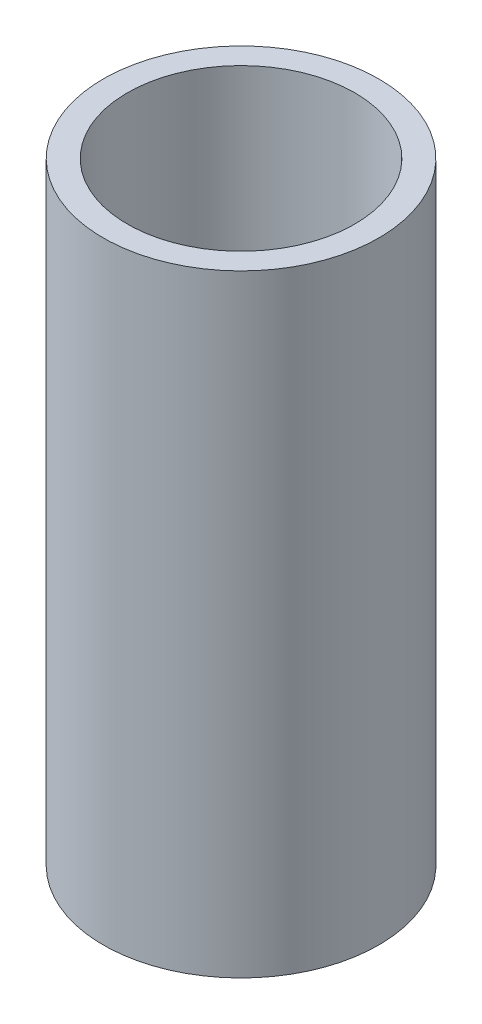
from build123d import *


with BuildPart() as part:
    # Szkic1 → Obrót1 (revolve)
    with BuildSketch(Plane.XY, mode=Mode.PRIVATE) as obr_t1_sk:
        Polygon((-19.02, 100.112987953), (-19.02, 7.330027816), (0, 7.330027816), (0, -1.629972184), (-9.51, -1.629972184), (-17.02, -2.287012047), (-23.04, -2.287012047), (-23.04, 100.112987953), align=None)
    revolve(obr_t1_sk.sketch.rotate(Axis((0, 0, 0), (0, 1, 0)), 270), axis=Axis((0, 0, 0), (0, 1, 0)))


solid = part.part
